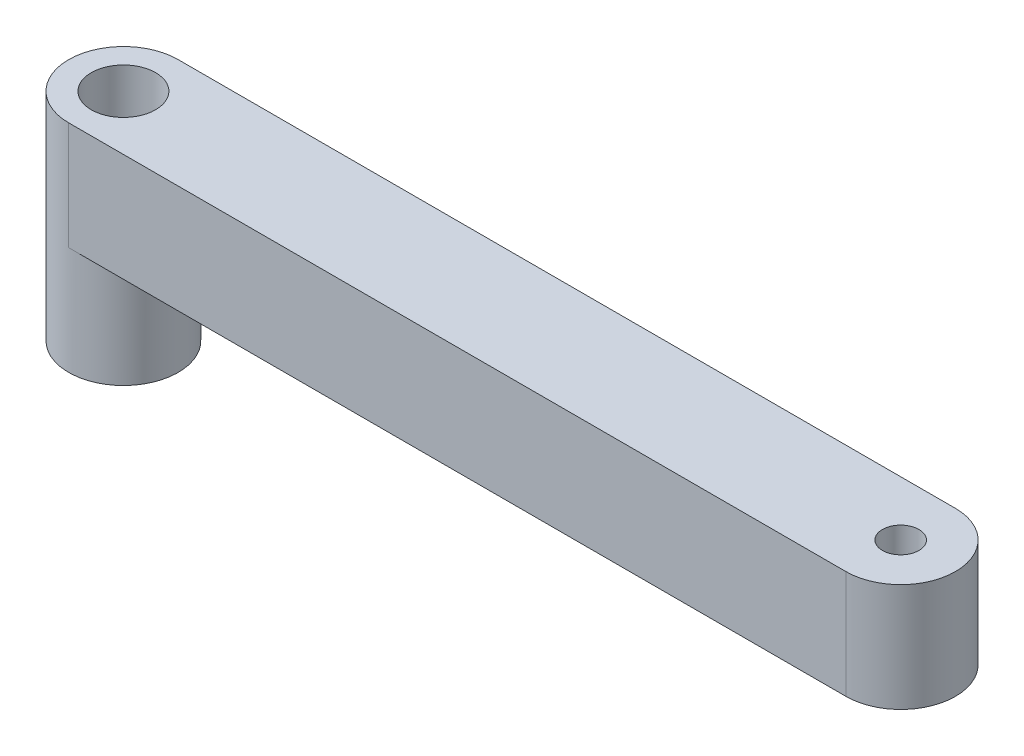
from build123d import *

# Parameters (mm, degrees)
SKETCH1_R           = 1.5875
SKETCH1_R_2         = 0.9
BOSS_EXTRUDE1_DEPTH = 5.334
BOSS_EXTRUDE2_START = 5.334
SKETCH2_R           = 2.701914089
SKETCH2_R_2         = 1.5875
BOSS_EXTRUDE2_DEPTH = 5.334


with BuildPart() as part:
    # Sketch1 → Boss-Extrude1 (new body)
    with BuildSketch(Plane(origin=(0, 0, 0), x_dir=(1, 0, 0), z_dir=(0, 1, 0))):
        with BuildLine():
            Line((-17.298840206, 4.645974227), (21.055159794, 4.645974227))
            ThreePointArc((21.055159794, 4.645974227), (23.757073883, 1.944060137), (21.055159794, -0.757853952))
            Line((21.055159794, -0.757853952), (-17.298840206, -0.757853952))
            ThreePointArc((-17.298840206, -0.757853952), (-20.000754296, 1.944060137), (-17.298840206, 4.645974227))
        make_face()
        with Locations(Location((-17.298840206, 1.944060137, 0), (0, 0, 270))):
            Circle(SKETCH1_R, mode=Mode.SUBTRACT)
        with Locations(Location((21.055159794, 1.944060137, 0), (0, 0, 270))):
            Circle(SKETCH1_R_2, mode=Mode.SUBTRACT)
    extrude(amount=BOSS_EXTRUDE1_DEPTH)

    # Sketch2 → Boss-Extrude2 (add)
    with BuildSketch(Plane.XZ.offset(BOSS_EXTRUDE2_START)):
        with Locations(Location((-17.298840206, -1.944060137, 0), (0, 0, 270))):
            Circle(SKETCH2_R)
        with Locations(Location((-17.298840206, -1.944060137, 0), (0, 0, 270))):
            Circle(SKETCH2_R_2, mode=Mode.SUBTRACT)
    extrude(amount=-BOSS_EXTRUDE2_DEPTH)


solid = part.part
